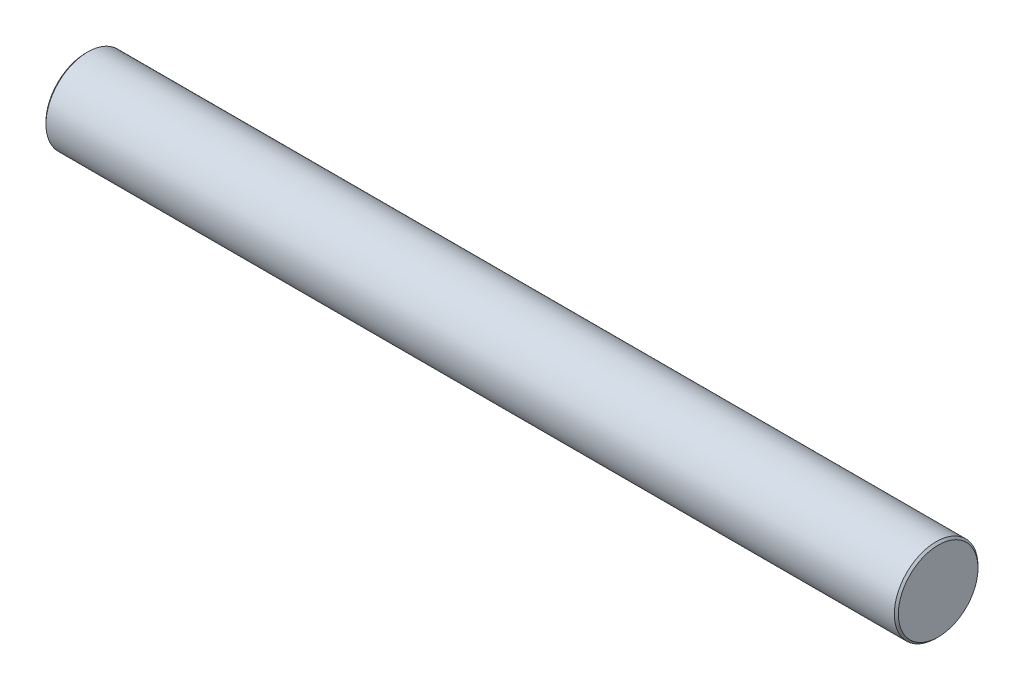
from build123d import *

# Parameters (mm, degrees)
SKETCH1_R           = 15.9
BOSS_EXTRUDE1_DEPTH = 161.925
CHAMFER1_SIZE       = 0.762


with BuildPart() as part:
    # Sketch1 → Boss-Extrude1 (new, symmetric)
    with BuildSketch(Plane(origin=(0, 0, 0), x_dir=(0, 0, -1), z_dir=(1, 0, 0))):
        Circle(SKETCH1_R)
    extrude(amount=BOSS_EXTRUDE1_DEPTH, both=True)

    # Chamfer1
    chamfer1_edges = [part.edges().sort_by_distance(p)[0] for p in [
        (-161.925, 0, 15.9),
        (161.925, 0, 15.9),
    ]]
    chamfer(chamfer1_edges, length=CHAMFER1_SIZE)


solid = part.part
